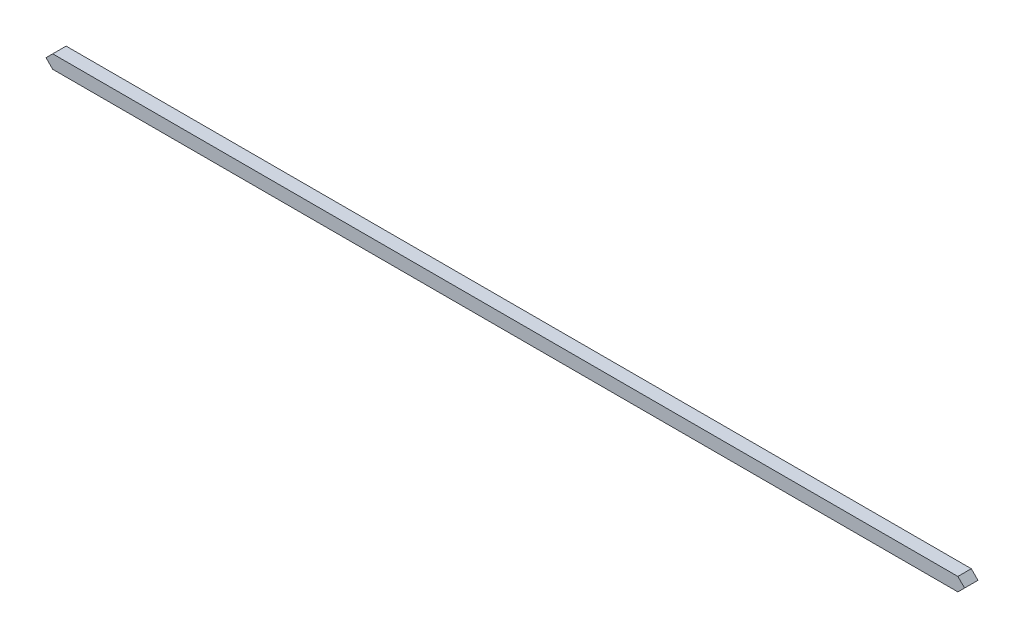
from build123d import *

# Parameters (mm, degrees)
BOSS_EXTRUDE1_DEPTH = 40


with BuildPart() as part:
    # Sketch2 → Boss-Extrude1 (new body)
    with BuildSketch(Plane.XY):
        Polygon((-1370, 0), (-1350, 20), (1350, 20), (1370, 0), (1350, -20), (-1350, -20), align=None)
    extrude(amount=BOSS_EXTRUDE1_DEPTH)


solid = part.part
